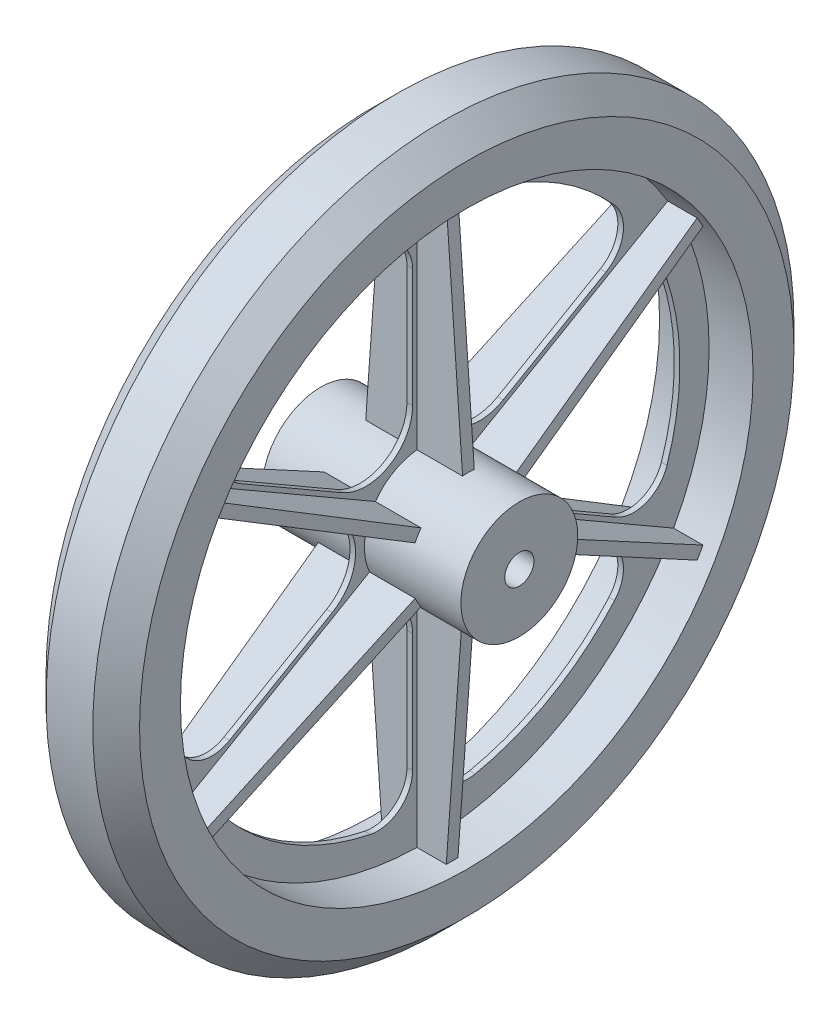
from build123d import *

# Parameters (mm, degrees)
SALIENTE_EXTRUIR4_DEPTH      = 26.9875
SALIENTE_EXTRUIR4_DEPTH_BACK = 26.9875
CROQUIS5_R                   = 15.875
SALIENTE_EXTRUIR5_DEPTH      = 0.762
SALIENTE_EXTRUIR5_DEPTH_BACK = 0.762
CROQUIS6_R                   = 95.25
SALIENTE_EXTRUIR6_DEPTH      = 12.7
SALIENTE_EXTRUIR6_DEPTH_BACK = 12.7
CROQUIS8_R                   = 95.25
CROQUIS8_R_2                 = 77.787
CORTAR_EXTRUIR1_DEPTH        = 138.532395276
MATRIZC1_COUNT               = 6
CROQUIS12_R                  = 3.969
CORTAR_EXTRUIR2_DEPTH        = 146.115215039
CHAFL_N1_SIZE                = 6.35


with BuildPart() as part:
    # Croquis5 → Saliente-Extruir4 (new, two sides: drawn at the far end of the back side and taken through both)
    with BuildSketch(Plane(origin=(0, 0, 0), x_dir=(0, 0, -1), z_dir=(1, 0, 0)).offset(-SALIENTE_EXTRUIR4_DEPTH_BACK)):
        Circle(CROQUIS5_R)
    extrude(amount=SALIENTE_EXTRUIR4_DEPTH + SALIENTE_EXTRUIR4_DEPTH_BACK)

    # Croquis6 → Saliente-Extruir5 (add, two sides: drawn at the far end of the back side and taken through both)
    with BuildSketch(Plane(origin=(0, 0, 0), x_dir=(0, 0, -1), z_dir=(1, 0, 0)).offset(-SALIENTE_EXTRUIR5_DEPTH_BACK)):
        Circle(CROQUIS6_R)
    extrude(amount=SALIENTE_EXTRUIR5_DEPTH + SALIENTE_EXTRUIR5_DEPTH_BACK)

    # Croquis8 → Saliente-Extruir6 (add, two sides: drawn at the far end of the back side and taken through both)
    with BuildSketch(Plane(origin=(0, 0, 0), x_dir=(0, 0, -1), z_dir=(1, 0, 0)).offset(-SALIENTE_EXTRUIR6_DEPTH_BACK)):
        Circle(CROQUIS8_R)
        Circle(CROQUIS8_R_2, mode=Mode.SUBTRACT)
    extrude(amount=SALIENTE_EXTRUIR6_DEPTH + SALIENTE_EXTRUIR6_DEPTH_BACK)

    # Croquis9 → Cortar-Extruir1 (cut, through all)
    with BuildSketch(Plane(origin=(0.762, 0, 0), x_dir=(0, 0, -1), z_dir=(1, 0, 0))):
        with BuildLine():
            Line((2.778, 26.8086824), (2.778, 59.057106397))
            ThreePointArc((2.778, 59.057106397), (6.2937338, 66.447258272), (14.245578947, 68.38191267))
            ThreePointArc((14.245578947, 68.38191267), (34.925, 60.491874454), (52.097684058, 46.527989595))
            ThreePointArc((52.097684058, 46.527989595), (54.398146776, 38.674162492), (49.755954414, 31.93437177))
            Line((49.755954414, 31.93437177), (21.828, 15.810159771))
            ThreePointArc((21.828, 15.810159771), (9.128, 15.810159771), (2.778, 26.8086824))
        make_face()
    cortar_extruir1 = extrude(amount=-CORTAR_EXTRUIR1_DEPTH, mode=Mode.SUBTRACT)

    # Croquis11 → Recubrir1 section 0
    with BuildSketch(Plane(origin=(0, 88.9, 0), x_dir=(1, 0, 0), z_dir=(0, 1, 0))):
        with BuildLine():
            Line((-7.9375, 1.5875), (7.9375, 1.5875))
            Line((7.9375, 1.5875), (7.9375, -1.5875))
            Line((7.9375, -1.5875), (-7.9375, -1.5875))
            Line((-7.9375, -1.5875), (-7.9375, 1.5875))
        make_face()
    # Croquis10 → Recubrir1 section 1
    with BuildSketch(Plane(origin=(0, 0, 0), x_dir=(1, 0, 0), z_dir=(0, 1, 0))):
        with BuildLine():
            Line((-14.2875, 1.5875), (14.2875, 1.5875))
            Line((14.2875, 1.5875), (14.2875, -1.5875))
            Line((14.2875, -1.5875), (-14.2875, -1.5875))
            Line((-14.2875, -1.5875), (-14.2875, 1.5875))
        make_face()
    recubrir1 = loft()

    # MatrizC1: Cortar-Extruir1, Recubrir1 ×6 about axis
    matrizc1_axis = Axis((-12.7, 0, 0), (1, 0, 0))
    add([cortar_extruir1.rotate(matrizc1_axis, i * 360 / MATRIZC1_COUNT) for i in range(1, MATRIZC1_COUNT)], mode=Mode.SUBTRACT)
    add([recubrir1.rotate(matrizc1_axis, i * 360 / MATRIZC1_COUNT) for i in range(1, MATRIZC1_COUNT)])

    # Croquis12 → Cortar-Extruir2 (cut, through all)
    with BuildSketch(Plane.ZY.offset(26.9875)):
        Circle(CROQUIS12_R)
    extrude(amount=-CORTAR_EXTRUIR2_DEPTH, mode=Mode.SUBTRACT)

    # Chaflán1
    chafl_n1_edges = [part.edges().sort_by_distance(p)[0] for p in [
        (12.7, 0, 95.25),
        (-12.7, 0, 95.25),
    ]]
    chamfer(chafl_n1_edges, length=CHAFL_N1_SIZE)


solid = part.part
